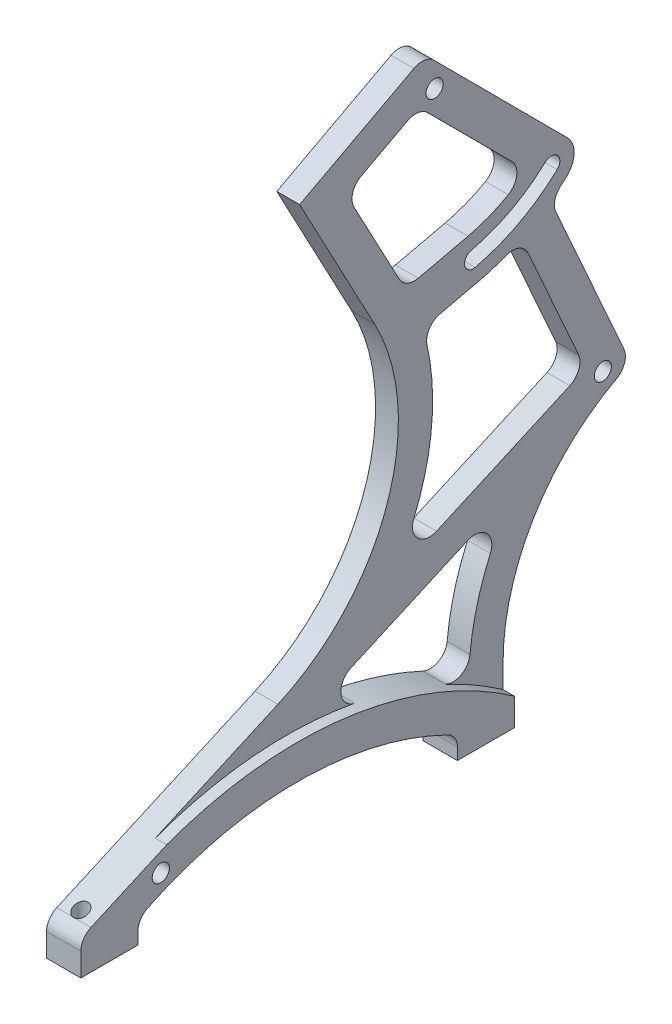
from build123d import *

# Parameters (mm, degrees)
SKETCH1_R                   = 1.5
BOSS_EXTRUDE1_DEPTH         = 6
FILLET1_R                   = 3
TAP_DRILL_FOR_M3_TAP1_D     = 2.5
TAP_DRILL_FOR_M3_TAP1_DEPTH = 8
TAP_DRILL_FOR_M3_TAP1_TIP   = 0.751075774
CUT_EXTRUDE1_START          = -2
CUT_EXTRUDE1_DEPTH          = 2
CUT_EXTRUDE2_REACH          = 147.011
SKETCH7_R                   = 1.5


with BuildPart() as part:
    # Sketch1 → Boss-Extrude1 (new body)
    with BuildSketch(Plane(origin=(0, 0, 0), x_dir=(0, 0, -1), z_dir=(1, 0, 0))):
        with BuildLine():
            Line((0, 0), (0, 6))
            Line((0, 6), (36.541818306, 22.269465723))
            ThreePointArc((36.541818306, 22.269465723), (55.71908903, 43.197784292), (53.491952961, 71.496231166))
            Line((53.491952961, 71.496231166), (40.346749203, 96.218763766))
            Line((40.346749203, 96.218763766), (62.341129166, 107.913383036))
            Line((62.341129166, 107.913383036), (87.292806812, 82.883380245))
            ThreePointArc((87.292806812, 82.883380245), (88.459285656, 79.986445673), (87.187944242, 77.133974145))
            ThreePointArc((87.187944242, 77.133974145), (85.791082043, 75.901173525), (84.328789644, 74.746737597))
            Line((84.328789644, 74.746737597), (95.922273052, 48.707347523))
            Line((95.922273052, 48.707347523), (98.362692911, 43.226074777))
            ThreePointArc((98.362692911, 43.226074777), (82.081212508, 29.320376834), (76, 8.790547467))
            Line((76, 8.790547467), (76, 0))
            Line((76, 0), (66, 0))
            Line((66, 0), (66, 3.884469182))
            ThreePointArc((66, 3.884469182), (38, 10.818472536), (10, 3.884469182))
            Line((10, 3.884469182), (10, 0))
            Line((10, 0), (0, 0))
        make_face()
        with Locations((64, 102)):
            Circle(SKETCH1_R, mode=Mode.SUBTRACT)
        with BuildLine():
            Line((78.174939554, 34.237907891), (39.032120003, 16.810401803))
            ThreePointArc((39.032120003, 16.810401803), (55.025629399, 14.584670036), (70, 8.541951295))
            Line((70, 8.541951295), (70, 8.790547467))
            ThreePointArc((70, 8.790547467), (72.093906618, 22.154657887), (78.174939554, 34.237907891))
        make_face(mode=Mode.SUBTRACT)
        with BuildLine():
            Line((56.201627065, 31.02257653), (90.441000307, 46.266927665))
            Line((90.441000307, 46.266927665), (79.173694043, 71.573711875))
            ThreePointArc((79.173694043, 71.573711875), (75.490729324, 70.000575949), (71.648335848, 68.871417797))
            Line((71.648335848, 68.871417797), (61.936537439, 66.629272466))
            ThreePointArc((61.936537439, 66.629272466), (63.129066114, 48.17201256), (56.201627065, 31.02257653))
        make_face(mode=Mode.SUBTRACT)
        with BuildLine():
            Line((80.108700039, 81.591428686), (61.231449963, 100.527935833))
            Line((61.231449963, 100.527935833), (48.461264136, 93.737907585))
            Line((48.461264136, 93.737907585), (58.884294031, 74.135039414))
            Line((58.884294031, 74.135039414), (69.848727413, 76.666378316))
            ThreePointArc((69.848727413, 76.666378316), (75.251497028, 78.560635362), (80.108700039, 81.591428686))
        make_face(mode=Mode.SUBTRACT)
        with BuildLine():
            ThreePointArc((71.085958212, 71.307342959), (78.788354228, 74.187150825), (85.482948342, 78.962358399))
            ThreePointArc((85.482948342, 78.962358399), (85.556981354, 81.082386492), (83.436953262, 81.156419504))
            ThreePointArc((83.436953262, 81.156419504), (77.379939539, 76.835993604), (70.411105049, 74.230453154))
            ThreePointArc((70.411105049, 74.230453154), (69.286976533, 72.431471475), (71.085958212, 71.307342959))
        make_face(mode=Mode.SUBTRACT)
    extrude(amount=BOSS_EXTRUDE1_DEPTH)

    # Fillet1
    fillet1_edges = [part.edges().sort_by_distance(p)[0] for p in [
        (3, 3.884469182, -66),
        (3, 3.884469182, -10),
        (3, 43.226074777, -98.362692911),
        (3, 16.810401803, -39.032120003),
        (3, 34.237907891, -78.174939554),
        (3, 8.541951295, -70),
        (3, 46.266927665, -90.441000307),
        (3, 31.02257653, -56.201627065),
        (3, 81.591428686, -80.108700039),
        (3, 107.913383036, -62.341129166),
        (3, 100.527935833, -61.231449963),
        (3, 93.737907585, -48.461264136),
        (3, 74.135039414, -58.884294031),
        (3, 6, 0),
        (3, 66.629272466, -61.936537439),
        (3, 74.746737597, -84.328789644),
        (3, 71.573711875, -79.173694043),
    ]]
    fillet(fillet1_edges, radius=FILLET1_R)

    # Tap Drill for M3 Tap1
    with Locations(Plane(origin=(0, 0, 0), x_dir=(-1, 0, 0), z_dir=(0, -1, 0))):
        with Locations((-3, 3), (-3, 70)):
            Hole(TAP_DRILL_FOR_M3_TAP1_D / 2, depth=TAP_DRILL_FOR_M3_TAP1_DEPTH)
            with Locations((0, 0, -(TAP_DRILL_FOR_M3_TAP1_DEPTH + TAP_DRILL_FOR_M3_TAP1_TIP / 2))):  # 118° drill point
                Cone(0, TAP_DRILL_FOR_M3_TAP1_D / 2, TAP_DRILL_FOR_M3_TAP1_TIP, mode=Mode.SUBTRACT)

    # Sketch6 → Cut-Extrude1 (cut)
    with BuildSketch(Plane(origin=(6, 0, 0), x_dir=(0, 0, -1), z_dir=(1, 0, 0)).offset(CUT_EXTRUDE1_START)):
        with BuildLine():
            Line((0, 6), (0, 120))
            Line((0, 120), (100, 120))
            Line((100, 120), (100, 4.781422789))
            Line((100, 4.781422789), (76, 4.781422789))
            ThreePointArc((76, 4.781422789), (42.323682099, 16.676697331), (7.381236086, 9.286338039))
            Line((7.381236086, 9.286338039), (0, 6))
        make_face()
    extrude(amount=CUT_EXTRUDE1_DEPTH, mode=Mode.SUBTRACT)

    # Sketch7 → Cut-Extrude2 (cut, up to next)
    with BuildSketch(Plane(origin=(6, 0, 0), x_dir=(0, 0, -1), z_dir=(1, 0, 0)), mode=Mode.PRIVATE) as cut_extrude2_sk1:
        with Locations((14.009846336, 8.95367663)):
            Circle(SKETCH7_R)
    cut_extrude2_tool1 = extrude(cut_extrude2_sk1.sketch, amount=-CUT_EXTRUDE2_REACH, mode=Mode.PRIVATE) & part.part
    # Sketch7 → Cut-Extrude2 (cut, up to next)
    with BuildSketch(Plane(origin=(6, 0, 0), x_dir=(0, 0, -1), z_dir=(1, 0, 0)), mode=Mode.PRIVATE) as cut_extrude2_sk2:
        with Locations((93.488301151, 44.339764578)):
            Circle(SKETCH7_R)
    cut_extrude2_tool2 = extrude(cut_extrude2_sk2.sketch, amount=-CUT_EXTRUDE2_REACH, mode=Mode.PRIVATE) & part.part
    add(cut_extrude2_tool1.solids().sort_by_distance((6, 8.953677, -14.009846))[0], mode=Mode.SUBTRACT)
    add(cut_extrude2_tool2.solids().sort_by_distance((6, 44.339765, -93.488301))[0], mode=Mode.SUBTRACT)


solid = part.part
